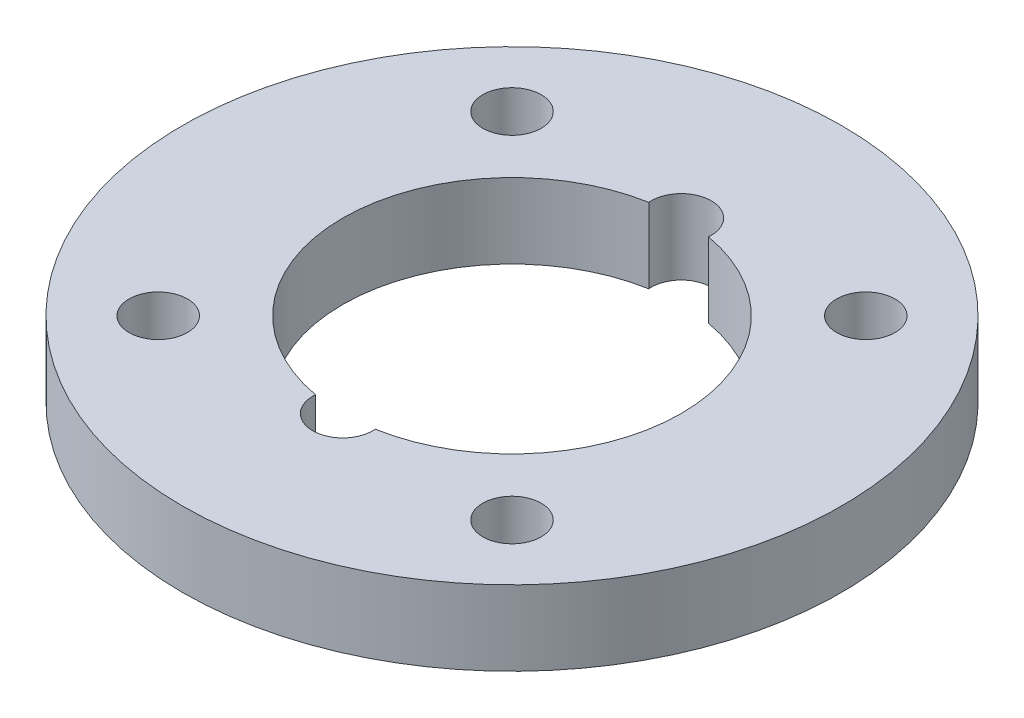
from build123d import *

# Parameters (mm, degrees)
F_0_5IN_SOCKET_R    = 27.94
F_0_5IN_SOCKET_R_2  = 2.475
BOSS_EXTRUDE1_DEPTH = 6.35


with BuildPart() as part:
    # 0.5in Socket → Boss-Extrude1 (new body)
    with BuildSketch(Plane(origin=(0, 0, 0), x_dir=(1, 0, 0), z_dir=(0, 1, 0))):
        with Locations(Location((0, 0, 0), (0, 0, 270))):
            Circle(F_0_5IN_SOCKET_R)
        with Locations(Location((-14.997027722, -14.997027722, 0), (0, 0, 270))):
            Circle(F_0_5IN_SOCKET_R_2, mode=Mode.SUBTRACT)
        with Locations(Location((-14.997027722, 14.997027722, 0), (0, 0, 270))):
            Circle(F_0_5IN_SOCKET_R_2, mode=Mode.SUBTRACT)
        with Locations(Location((14.997027722, 14.997027722, 0), (0, 0, 270))):
            Circle(F_0_5IN_SOCKET_R_2, mode=Mode.SUBTRACT)
        with Locations(Location((14.997027722, -14.997027722, 0), (0, 0, 270))):
            Circle(F_0_5IN_SOCKET_R_2, mode=Mode.SUBTRACT)
        with BuildLine():
            ThreePointArc((2.530034488, -14.126221239), (0, -16.891), (-2.530034488, -14.126221239))
            ThreePointArc((-2.530034488, -14.126221239), (-14.351, 0), (-2.530034488, 14.126221239))
            ThreePointArc((-2.530034488, 14.126221239), (0, 16.891), (2.530034488, 14.126221239))
            ThreePointArc((2.530034488, 14.126221239), (14.351, 0), (2.530034488, -14.126221239))
        make_face(mode=Mode.SUBTRACT)
    extrude(amount=BOSS_EXTRUDE1_DEPTH)


solid = part.part
